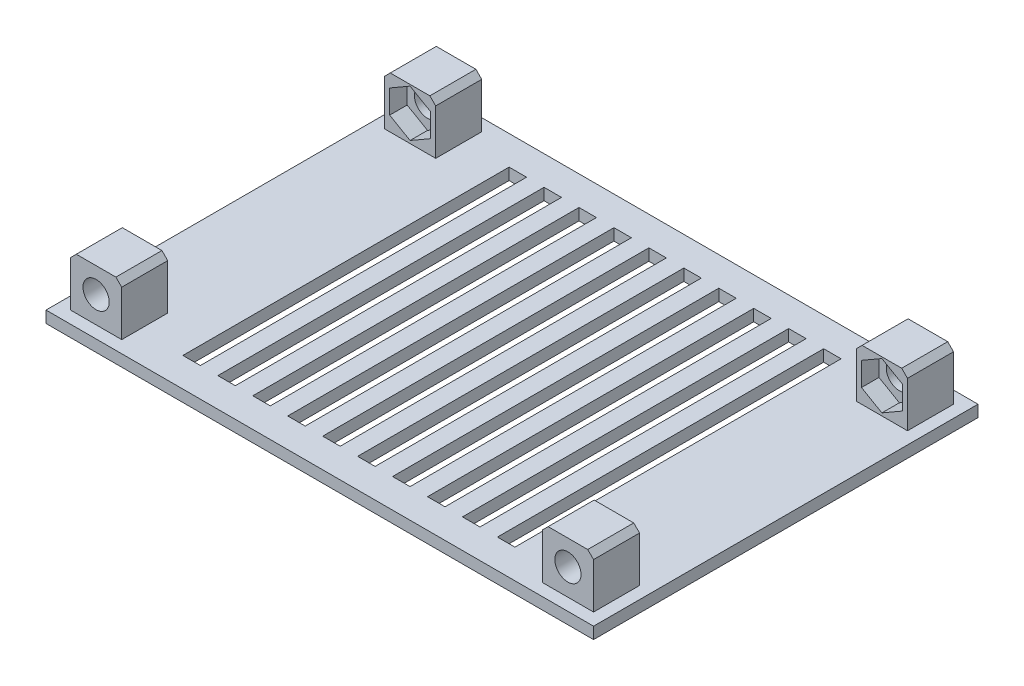
from build123d import *

# Parameters (mm, degrees)
SKETCH1_W            = 94
SKETCH1_H            = 66
BOSS_EXTRUDE1_DEPTH  = 2
SKETCH2_W            = 8.8
SKETCH2_H            = 7.9
BOSS_EXTRUDE2_DEPTH  = 8.8
SKETCH3_R            = 2.25
CUT_EXTRUDE1_DEPTH   = 81.055293392
CUT_EXTRUDE2_DEPTH   = 3
CHAMFER1_SIZE        = 1
MIRROR2_COPY_1_DEPTH = 3
CUT_EXTRUDE3_REACH   = 60.099
SKETCH6_W            = 3
SKETCH6_H            = 56


with BuildPart() as part:
    # Sketch1 → Boss-Extrude1 (new body)
    with BuildSketch(Plane(origin=(0, 0, 0), x_dir=(1, 0, 0), z_dir=(0, 1, 0))):
        Rectangle(SKETCH1_W, SKETCH1_H)
    extrude(amount=BOSS_EXTRUDE1_DEPTH)

    # Sketch2 → Boss-Extrude2 (add)
    with BuildSketch(Plane(origin=(0, 2, 0), x_dir=(1, 0, 0), z_dir=(0, 1, 0))):
        with Locations((-40.5, -26.95)):
            Rectangle(SKETCH2_W, SKETCH2_H)
        with Locations((40.5, -26.95)):
            Rectangle(SKETCH2_W, SKETCH2_H)
        with Locations((40.5, 26.95)):
            Rectangle(SKETCH2_W, SKETCH2_H)
        with Locations((-40.5, 26.95)):
            Rectangle(SKETCH2_W, SKETCH2_H)
    extrude(amount=BOSS_EXTRUDE2_DEPTH)

    # Sketch3 → Cut-Extrude1 (cut, through all)
    with BuildSketch(Plane.XY.offset(30.9)):
        with Locations((-40.5, 6.5)):
            Circle(SKETCH3_R)
        with Locations((40.5, 6.5)):
            Circle(SKETCH3_R)
    extrude(amount=-CUT_EXTRUDE1_DEPTH, mode=Mode.SUBTRACT)

    # Sketch5 → Cut-Extrude2 (cut)
    with BuildSketch(Plane.XY.offset(-23)):
        Polygon((-40.5, 10.541451884), (-44, 8.520725942), (-44, 4.479274058), (-40.5, 2.458548116), (-37, 4.479274058), (-37, 8.520725942), align=None)
    cut_extrude2 = extrude(amount=-CUT_EXTRUDE2_DEPTH, mode=Mode.SUBTRACT)

    # Chamfer1
    chamfer1_edges = [part.edges().sort_by_distance(p)[0] for p in [
        (-44.9, 10.8, 26.95),
        (-36.1, 10.8, 26.95),
        (44.9, 10.8, 26.95),
        (36.1, 10.8, 26.95),
        (36.1, 10.8, -26.95),
        (44.9, 10.8, -26.95),
        (-44.9, 10.8, -26.95),
        (-36.1, 10.8, -26.95),
    ]]
    chamfer(chamfer1_edges, length=CHAMFER1_SIZE)

    # Mirror1: Cut-Extrude2 across plane
    add(cut_extrude2.mirror(Plane.XY), mode=Mode.SUBTRACT)

    # Mirror2: Cut-Extrude2 across plane
    add(cut_extrude2.mirror(Plane(origin=(0, 0, 0), x_dir=(0, 0, 1), z_dir=(1, 0, 0))), mode=Mode.SUBTRACT)

    # Mirror2 copy 1 sketch → Mirror2 copy 1 (cut)
    with BuildSketch(Plane(origin=(0, 0, 23), x_dir=(-1, 0, 0), z_dir=(0, 0, -1))):
        Polygon((-40.5, 10.541451884), (-44, 8.520725942), (-44, 4.479274058), (-40.5, 2.458548116), (-37, 4.479274058), (-37, 8.520725942), align=None)
    extrude(amount=-MIRROR2_COPY_1_DEPTH, mode=Mode.SUBTRACT)

    # Sketch6 → Cut-Extrude3 (cut, up to next)
    with BuildSketch(Plane(origin=(0, 2, 0), x_dir=(1, 0, 0), z_dir=(0, 1, 0)), mode=Mode.PRIVATE) as cut_extrude3_sk1:
        with Locations((-3, 0)):
            Rectangle(SKETCH6_W, SKETCH6_H)
    cut_extrude3_tool1 = extrude(cut_extrude3_sk1.sketch, amount=-CUT_EXTRUDE3_REACH, mode=Mode.PRIVATE) & part.part
    # Sketch6 → Cut-Extrude3 (cut, up to next)
    with BuildSketch(Plane(origin=(0, 2, 0), x_dir=(1, 0, 0), z_dir=(0, 1, 0)), mode=Mode.PRIVATE) as cut_extrude3_sk2:
        with Locations((-9, 0)):
            Rectangle(SKETCH6_W, SKETCH6_H)
    cut_extrude3_tool2 = extrude(cut_extrude3_sk2.sketch, amount=-CUT_EXTRUDE3_REACH, mode=Mode.PRIVATE) & part.part
    # Sketch6 → Cut-Extrude3 (cut, up to next)
    with BuildSketch(Plane(origin=(0, 2, 0), x_dir=(1, 0, 0), z_dir=(0, 1, 0)), mode=Mode.PRIVATE) as cut_extrude3_sk3:
        with Locations((-15, 0)):
            Rectangle(SKETCH6_W, SKETCH6_H)
    cut_extrude3_tool3 = extrude(cut_extrude3_sk3.sketch, amount=-CUT_EXTRUDE3_REACH, mode=Mode.PRIVATE) & part.part
    # Sketch6 → Cut-Extrude3 (cut, up to next)
    with BuildSketch(Plane(origin=(0, 2, 0), x_dir=(1, 0, 0), z_dir=(0, 1, 0)), mode=Mode.PRIVATE) as cut_extrude3_sk4:
        with Locations((-21, 0)):
            Rectangle(SKETCH6_W, SKETCH6_H)
    cut_extrude3_tool4 = extrude(cut_extrude3_sk4.sketch, amount=-CUT_EXTRUDE3_REACH, mode=Mode.PRIVATE) & part.part
    # Sketch6 → Cut-Extrude3 (cut, up to next)
    with BuildSketch(Plane(origin=(0, 2, 0), x_dir=(1, 0, 0), z_dir=(0, 1, 0)), mode=Mode.PRIVATE) as cut_extrude3_sk5:
        with Locations((-27, 0)):
            Rectangle(SKETCH6_W, SKETCH6_H)
    cut_extrude3_tool5 = extrude(cut_extrude3_sk5.sketch, amount=-CUT_EXTRUDE3_REACH, mode=Mode.PRIVATE) & part.part
    # Sketch6 → Cut-Extrude3 (cut, up to next)
    with BuildSketch(Plane(origin=(0, 2, 0), x_dir=(1, 0, 0), z_dir=(0, 1, 0)), mode=Mode.PRIVATE) as cut_extrude3_sk6:
        with Locations((3, 0)):
            Rectangle(SKETCH6_W, SKETCH6_H)
    cut_extrude3_tool6 = extrude(cut_extrude3_sk6.sketch, amount=-CUT_EXTRUDE3_REACH, mode=Mode.PRIVATE) & part.part
    # Sketch6 → Cut-Extrude3 (cut, up to next)
    with BuildSketch(Plane(origin=(0, 2, 0), x_dir=(1, 0, 0), z_dir=(0, 1, 0)), mode=Mode.PRIVATE) as cut_extrude3_sk7:
        with Locations((9, 0)):
            Rectangle(SKETCH6_W, SKETCH6_H)
    cut_extrude3_tool7 = extrude(cut_extrude3_sk7.sketch, amount=-CUT_EXTRUDE3_REACH, mode=Mode.PRIVATE) & part.part
    # Sketch6 → Cut-Extrude3 (cut, up to next)
    with BuildSketch(Plane(origin=(0, 2, 0), x_dir=(1, 0, 0), z_dir=(0, 1, 0)), mode=Mode.PRIVATE) as cut_extrude3_sk8:
        with Locations((15, 0)):
            Rectangle(SKETCH6_W, SKETCH6_H)
    cut_extrude3_tool8 = extrude(cut_extrude3_sk8.sketch, amount=-CUT_EXTRUDE3_REACH, mode=Mode.PRIVATE) & part.part
    # Sketch6 → Cut-Extrude3 (cut, up to next)
    with BuildSketch(Plane(origin=(0, 2, 0), x_dir=(1, 0, 0), z_dir=(0, 1, 0)), mode=Mode.PRIVATE) as cut_extrude3_sk9:
        with Locations((21, 0)):
            Rectangle(SKETCH6_W, SKETCH6_H)
    cut_extrude3_tool9 = extrude(cut_extrude3_sk9.sketch, amount=-CUT_EXTRUDE3_REACH, mode=Mode.PRIVATE) & part.part
    # Sketch6 → Cut-Extrude3 (cut, up to next)
    with BuildSketch(Plane(origin=(0, 2, 0), x_dir=(1, 0, 0), z_dir=(0, 1, 0)), mode=Mode.PRIVATE) as cut_extrude3_sk10:
        with Locations((27, 0)):
            Rectangle(SKETCH6_W, SKETCH6_H)
    cut_extrude3_tool10 = extrude(cut_extrude3_sk10.sketch, amount=-CUT_EXTRUDE3_REACH, mode=Mode.PRIVATE) & part.part
    add(cut_extrude3_tool1.solids().sort_by_distance((-3, 2, 0))[0], mode=Mode.SUBTRACT)
    add(cut_extrude3_tool2.solids().sort_by_distance((-9, 2, 0))[0], mode=Mode.SUBTRACT)
    add(cut_extrude3_tool3.solids().sort_by_distance((-15, 2, 0))[0], mode=Mode.SUBTRACT)
    add(cut_extrude3_tool4.solids().sort_by_distance((-21, 2, 0))[0], mode=Mode.SUBTRACT)
    add(cut_extrude3_tool5.solids().sort_by_distance((-27, 2, 0))[0], mode=Mode.SUBTRACT)
    add(cut_extrude3_tool6.solids().sort_by_distance((3, 2, 0))[0], mode=Mode.SUBTRACT)
    add(cut_extrude3_tool7.solids().sort_by_distance((9, 2, 0))[0], mode=Mode.SUBTRACT)
    add(cut_extrude3_tool8.solids().sort_by_distance((15, 2, 0))[0], mode=Mode.SUBTRACT)
    add(cut_extrude3_tool9.solids().sort_by_distance((21, 2, 0))[0], mode=Mode.SUBTRACT)
    add(cut_extrude3_tool10.solids().sort_by_distance((27, 2, 0))[0], mode=Mode.SUBTRACT)


solid = part.part
